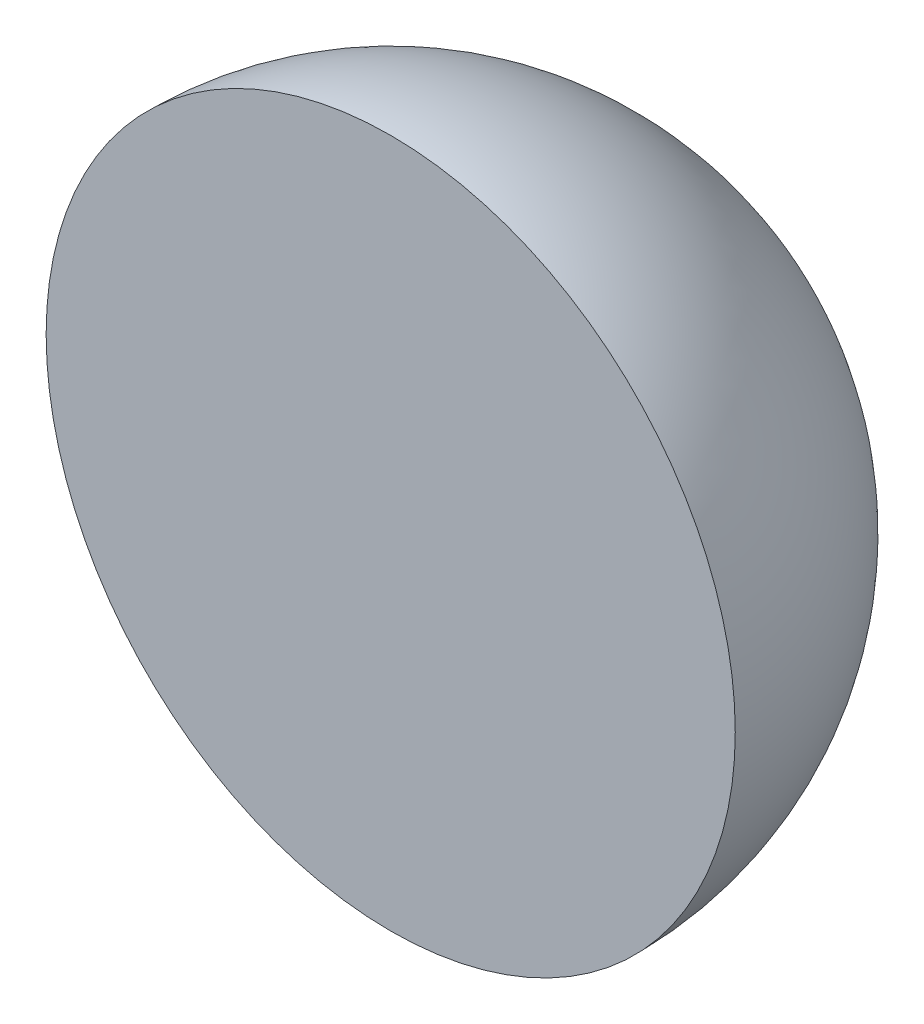
from build123d import *


with BuildPart() as part:
    # Sketch1 → Revolve1 (revolve)
    with BuildSketch(Plane(origin=(0, 0, 0), x_dir=(1, 0, 0), z_dir=(0, 1, 0))):
        with BuildLine():
            Line((0, 42), (0, 0))
            Line((0, 0), (42, 0))
            ThreePointArc((42, 0), (29.69848481, 29.69848481), (0, 42))
        make_face()
    revolve(axis=Axis((0, 0, -42), (0, 0, 1)))


solid = part.part
